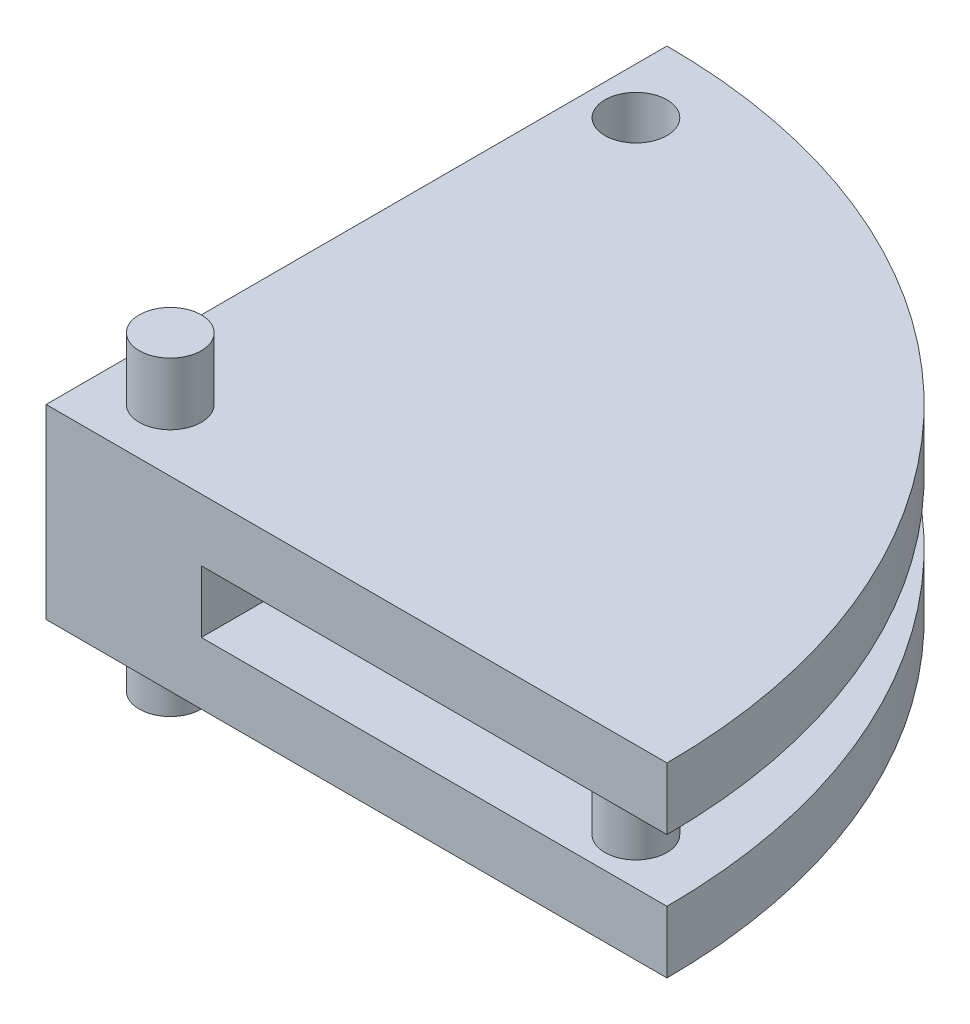
from build123d import *

# Parameters (mm, degrees)
BOSS_EXTRUDE1_DEPTH      = 1
SKETCH2_R                = 0.5
SKETCH2_W                = 2.5
SKETCH2_H                = 2.5
BOSS_EXTRUDE2_DEPTH      = 1
BOSS_EXTRUDE3_DEPTH      = 1
SKETCH4_R                = 0.5
CUT_EXTRUDE1_DEPTH       = 15.456832295
BOSS_EXTRUDE4_DEPTH      = 1
BOSS_EXTRUDE4_DEPTH_BACK = 4
SKETCH5_R                = 0.5


with BuildPart() as part:
    # Sketch1 → Boss-Extrude1 (new body)
    with BuildSketch(Plane(origin=(0, 0, 0), x_dir=(1, 0, 0), z_dir=(0, 1, 0))):
        with BuildLine():
            Line((0, 0), (10, 0))
            ThreePointArc((10, 0), (7.071067812, 7.071067812), (0, 10))
            Line((0, 10), (0, 0))
        make_face()
    extrude(amount=BOSS_EXTRUDE1_DEPTH)

    # Sketch2 → Boss-Extrude2 (add)
    with BuildSketch(Plane(origin=(0, 1, 0), x_dir=(1, 0, 0), z_dir=(0, 1, 0))):
        with Locations(Location((8.75, 0.75, 0), (0, 0, 90))):
            Circle(SKETCH2_R)
        with Locations((1.25, 1.25)):
            Rectangle(SKETCH2_W, SKETCH2_H)
    extrude(amount=BOSS_EXTRUDE2_DEPTH)

    # Sketch3 → Boss-Extrude3 (add)
    with BuildSketch(Plane(origin=(0, 2, 0), x_dir=(1, 0, 0), z_dir=(0, 1, 0))):
        with BuildLine():
            Line((0, 10), (0, 0))
            Line((0, 0), (10, 0))
            ThreePointArc((10, 0), (7.071067812, 7.071067812), (0, 10))
        make_face()
    extrude(amount=BOSS_EXTRUDE3_DEPTH)

    # Sketch4 → Cut-Extrude1 (cut, through all)
    with BuildSketch(Plane(origin=(0, 3, 0), x_dir=(1, 0, 0), z_dir=(0, 1, 0))):
        with Locations(Location((0.75, 8.75, 0), (0, 0, 270))):
            Circle(SKETCH4_R)
    extrude(amount=-CUT_EXTRUDE1_DEPTH, mode=Mode.SUBTRACT)

    # Sketch5 → Boss-Extrude4 (add, two sides: drawn at the far end of the back side and taken through both)
    with BuildSketch(Plane(origin=(0, 3, 0), x_dir=(1, 0, 0), z_dir=(0, 1, 0)).offset(-BOSS_EXTRUDE4_DEPTH_BACK)):
        with Locations(Location((1, 1, 0), (0, 0, 270))):
            Circle(SKETCH5_R)
    extrude(amount=BOSS_EXTRUDE4_DEPTH + BOSS_EXTRUDE4_DEPTH_BACK)


solid = part.part
